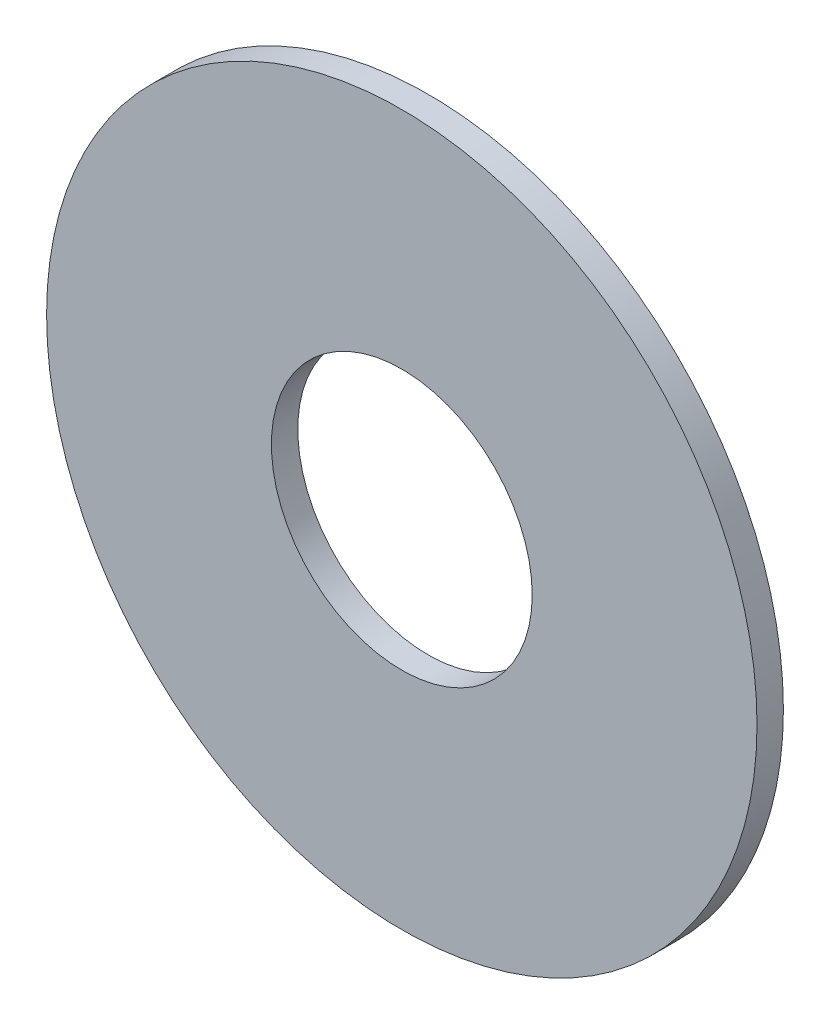
from build123d import *

# Parameters (mm, degrees)
SKETCH1_R           = 8.89
SKETCH1_R_2         = 3.2639
BOSS_EXTRUDE1_DEPTH = 0.6604


with BuildPart() as part:
    # Sketch1 → Boss-Extrude1 (new body)
    with BuildSketch(Plane.XY):
        Circle(SKETCH1_R)
        Circle(SKETCH1_R_2, mode=Mode.SUBTRACT)
    extrude(amount=BOSS_EXTRUDE1_DEPTH)


solid = part.part
